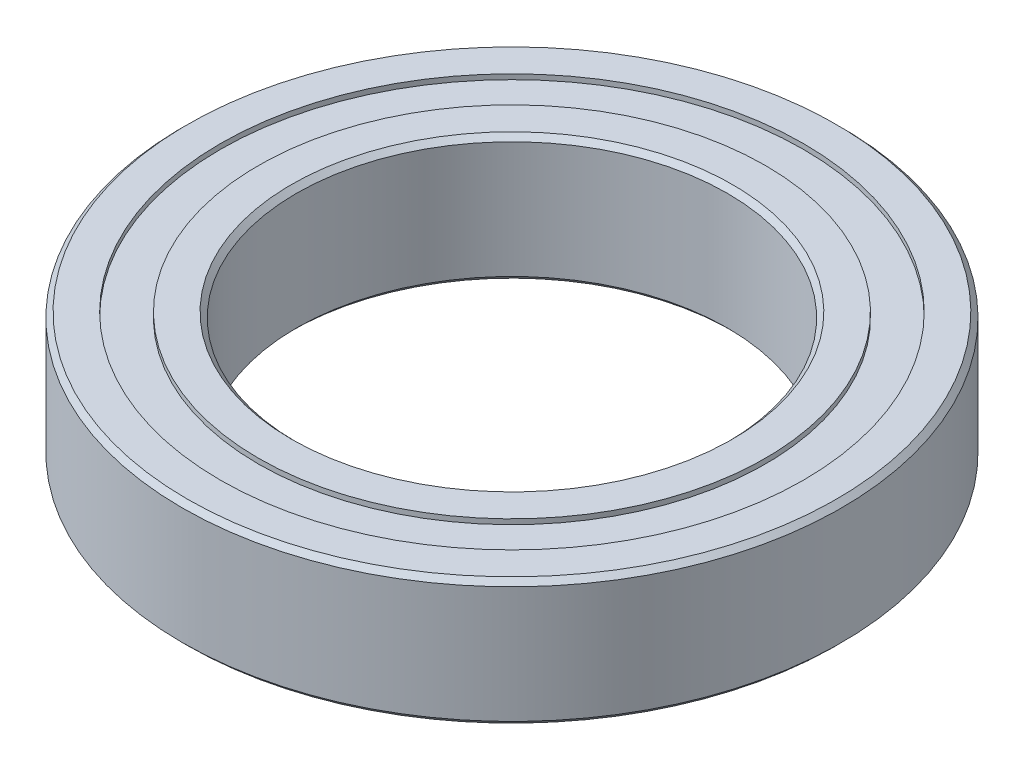
from build123d import *

# Parameters (mm, degrees)
SKETCH1_R           = 13
SKETCH1_R_2         = 8.5
BOSS_EXTRUDE1_DEPTH = 5
SKETCH2_R           = 11.5
SKETCH2_R_2         = 10
CUT_EXTRUDE1_DEPTH  = 0.2
CUT_EXTRUDE2_START  = -0.2
SKETCH3_R           = 11.5
SKETCH3_R_2         = 10
CUT_EXTRUDE2_DEPTH  = 0.2
CHAMFER1_SIZE       = 0.2


with BuildPart() as part:
    # Sketch1 → Boss-Extrude1 (new body)
    with BuildSketch(Plane(origin=(0, 0, 0), x_dir=(1, 0, 0), z_dir=(0, 1, 0))):
        with Locations(Location((0, 0, 0), (0, 0, 270))):
            Circle(SKETCH1_R)
        with Locations(Location((0, 0, 0), (0, 0, 270))):
            Circle(SKETCH1_R_2, mode=Mode.SUBTRACT)
    extrude(amount=BOSS_EXTRUDE1_DEPTH)

    # Sketch2 → Cut-Extrude1 (cut)
    with BuildSketch(Plane(origin=(0, 5, 0), x_dir=(1, 0, 0), z_dir=(0, 1, 0))):
        with Locations(Location((0, 0, 0), (0, 0, 270))):
            Circle(SKETCH2_R)
        with Locations(Location((0, 0, 0), (0, 0, 270))):
            Circle(SKETCH2_R_2, mode=Mode.SUBTRACT)
    extrude(amount=-CUT_EXTRUDE1_DEPTH, mode=Mode.SUBTRACT)

    # Sketch3 → Cut-Extrude2 (cut)
    with BuildSketch(Plane.XZ.offset(CUT_EXTRUDE2_START)):
        with Locations(Location((0, 0, 0), (0, 0, 90))):
            Circle(SKETCH3_R)
        with Locations(Location((0, 0, 0), (0, 0, 90))):
            Circle(SKETCH3_R_2, mode=Mode.SUBTRACT)
    extrude(amount=CUT_EXTRUDE2_DEPTH, mode=Mode.SUBTRACT)

    # Chamfer1
    chamfer1_edges = [part.edges().sort_by_distance(p)[0] for p in [
        (0, 0, -13),
        (0, 5, -13),
        (0, 0, -8.5),
        (0, 5, -8.5),
    ]]
    chamfer(chamfer1_edges, length=CHAMFER1_SIZE)


solid = part.part
